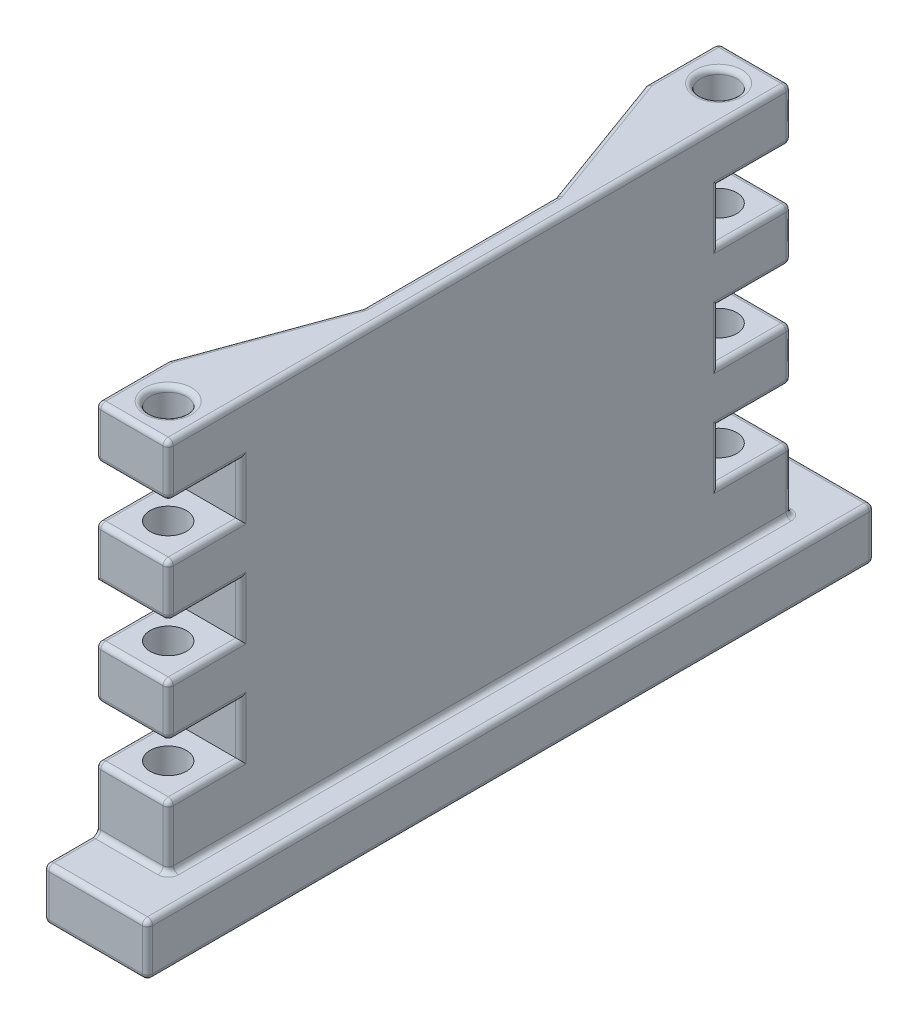
from build123d import *

# Parameters (mm, degrees)
BOSS_EXTRUDE1_DEPTH     = 7
CUT_EXTRUDE3_DEPTH      = 47.151923037
CUT_EXTRUDE3_DEPTH_BACK = 47.151923037
SKETCH7_R               = 1.75
SKETCH3_W               = 35
SKETCH3_H               = 5
BOSS_EXTRUDE2_DEPTH     = 3
CUT_EXTRUDE4_DEPTH      = 47.701177715
CUT_EXTRUDE4_DEPTH_BACK = 5
SKETCH7_3_R             = 1.75
CUT_EXTRUDE5_DEPTH      = 39
FILLET1_R               = 0.5


with BuildPart() as part:
    # Sketch1 → Boss-Extrude1 (new body)
    with BuildSketch(Plane(origin=(0, 0, 0), x_dir=(0, 0, -1), z_dir=(1, 0, 0))):
        Polygon((-20, -20.5), (-15, -20.5), (15, -20.5), (15, 20.5), (-8, 20.5), (-15, 20.5), (-15, 15.5), (-8, 15.5), (-8, 10.5), (-15, 10.5), (-15, 5.5), (-8, 5.5), (-8, 0.5), (-15, 0.5), (-15, -4.5), (-8, -4.5), (-8, -9.5), (-15, -9.5), (-15, -15.5), (-20, -15.5), align=None)
    extrude(amount=BOSS_EXTRUDE1_DEPTH)

    # Sketch7 → Cut-Extrude3 (cut, two sides: drawn at the far end of the back side and taken through both)
    with BuildSketch(Plane.XZ.offset(20.5).offset(-CUT_EXTRUDE3_DEPTH_BACK)):
        with Locations((3.5, 11.5)):
            Circle(SKETCH7_R)
    extrude(amount=CUT_EXTRUDE3_DEPTH + CUT_EXTRUDE3_DEPTH_BACK, mode=Mode.SUBTRACT)

    # Sketch3 → Boss-Extrude2 (add)
    with BuildSketch(Plane(origin=(7, 0, 0), x_dir=(0, 0, -1), z_dir=(1, 0, 0))):
        with Locations((-2.5, -18)):
            Rectangle(SKETCH3_W, SKETCH3_H)
    extrude(amount=BOSS_EXTRUDE2_DEPTH)

    # Sketch7<3> → Cut-Extrude4 (cut, two sides: drawn at the far end of the back side and taken through both)
    with BuildSketch(Plane.XZ.offset(20.5).offset(-CUT_EXTRUDE4_DEPTH_BACK)):
        Polygon((0.671258352, 13.12451655), (0.678756575, 9.862496147), (3.507498223, 8.237979597), (6.328741648, 9.87548345), (6.321243425, 13.137503853), (3.492501777, 14.762020403), align=None)
        with Locations((3.5, 11.5)):
            Circle(SKETCH7_3_R, mode=Mode.SUBTRACT)
    extrude(amount=CUT_EXTRUDE4_DEPTH + CUT_EXTRUDE4_DEPTH_BACK, mode=Mode.SUBTRACT)

    # Sketch8 → Cut-Extrude5 (cut)
    with BuildSketch(Plane(origin=(0, 20.5, 0), x_dir=(1, 0, 0), z_dir=(0, 1, 0))):
        Polygon((0, -8), (5, 5.737387097), (5, 15), (0, 15), align=None)
    extrude(amount=-CUT_EXTRUDE5_DEPTH, mode=Mode.SUBTRACT)

    # Mirror2: part across plane


with BuildPart() as part_1:
    add(part.part)
    add(part.part.mirror(Plane(origin=(7, 0, -15), x_dir=(1, 0, 0), z_dir=(0, 0, 1))))

    # Fillet1
    fillet1_edges = [part_1.edges().sort_by_distance(p)[0] for p in [
        (3.5, -9.5, 15),
        (3.5, -15.5, 15),
        (0, -12.5, 15),
        (5, -15.5, 20),
        (5, -20.5, 20),
        (0, -18, 20),
        (5, -20.5, -50),
        (5, -15.5, -50),
        (0, -18, -50),
        (3.5, -15.5, -45),
        (3.5, -9.5, -45),
        (0, -12.5, -45),
        (3.5, -4.5, -45),
        (3.5, 0.5, -45),
        (0, -2, -45),
        (3.5, 5.5, -45),
        (3.5, 10.5, -45),
        (0, 8, -45),
        (3.5, 15.5, -45),
        (0, 18, -45),
        (3.5, 15.5, 15),
        (0, 18, 15),
        (3.5, 10.5, 15),
        (3.5, 5.5, 15),
        (0, 8, 15),
        (3.5, 0.5, 15),
        (3.5, -4.5, 15),
        (0, -2, 15),
        (5, 1, -5.737387097),
        (5, 1, -24.262612903),
        (7, -9.5, 11.5),
        (7, -7, 8),
        (7, -4.5, 11.5),
        (7, -2, 15),
        (7, 0.5, 11.5),
        (7, 3, 8),
        (7, 5.5, 11.5),
        (7, 8, 15),
        (7, 10.5, 11.5),
        (7, 13, 8),
        (7, 15.5, 11.5),
        (7, 18, 15),
        (7, 18, -45),
        (7, 15.5, -41.5),
        (7, 13, -38),
        (7, 10.5, -41.5),
        (7, 8, -45),
        (7, 5.5, -41.5),
        (7, 3, -38),
        (7, 0.5, -41.5),
        (7, -2, -45),
        (7, -4.5, -41.5),
        (7, -7, -38),
        (7, -9.5, -41.5),
        (7, -12.5, -45),
        (7, -15.5, -15),
        (7, -12.5, 15),
        (1.75, 20.5, -41.5),
        (1.75, 20.5, 11.5),
        (5, 20.5, -15),
        (2.5, 20.5, -31.131306451),
        (0, 20.5, -41.5),
        (3.5, 20.5, -45),
        (7, 20.5, -15),
        (3.5, 20.5, 15),
        (0, 20.5, 11.5),
        (2.5, 20.5, 1.131306451),
        (0, -4.5, 11.5),
        (0, 0.5, 11.5),
        (0, 10.5, 11.5),
        (0, 15.5, 11.5),
        (0, -9.5, 11.5),
        (0, -15.5, 17.5),
        (0, 15.5, -41.5),
        (0, 10.5, -41.5),
        (0, 5.5, -41.5),
        (0, -4.5, -41.5),
        (0, 0.5, -41.5),
        (0, -9.5, -41.5),
        (0, -15.5, -47.5),
        (0, -20.5, -15),
        (5, -18.5, -15),
        (0, -18.5, -15),
        (10, -18, 20),
        (10, -18, -50),
        (10, -20.5, -15),
        (10, -15.5, -15),
    ]]
    fillet(fillet1_edges, radius=FILLET1_R)


solid = part_1.part
